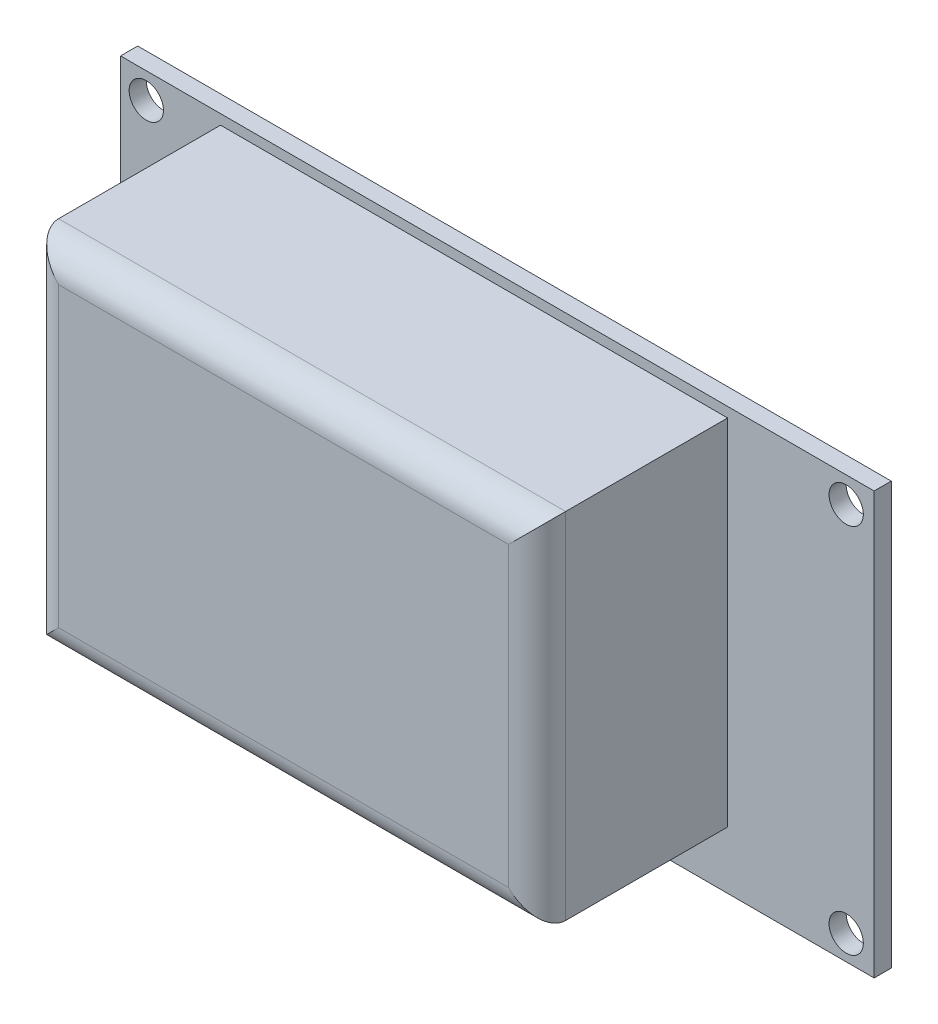
from build123d import *

# Parameters (mm, degrees)
SKETCH1_W           = 67
SKETCH1_H           = 37.49999993
BOSS_EXTRUDE1_DEPTH = 1.524
SKETCH2_R           = 1.524
CUT_EXTRUDE1_DEPTH  = 1.524
SKETCH3_W           = 45.085
SKETCH3_H           = 31.496
BOSS_EXTRUDE2_DEPTH = 16.9418
FILLET1_R           = 2.54


with BuildPart() as part:
    # Sketch1 → Boss-Extrude1 (new body)
    with BuildSketch(Plane.XY):
        Rectangle(SKETCH1_W, SKETCH1_H)
    extrude(amount=BOSS_EXTRUDE1_DEPTH)

    # Sketch2 → Cut-Extrude1 (cut)
    with BuildSketch(Plane.XY.offset(1.524)):
        with Locations((-31.214, 16.463999965)):
            Circle(SKETCH2_R)
        with Locations((31.016, 16.463999965)):
            Circle(SKETCH2_R)
        with Locations((-31.214, -16.556000035)):
            Circle(SKETCH2_R)
        with Locations((31.016, -16.556000035)):
            Circle(SKETCH2_R)
    extrude(amount=-CUT_EXTRUDE1_DEPTH, mode=Mode.SUBTRACT)

    # Sketch3 → Boss-Extrude2 (add)
    with BuildSketch(Plane.XY.offset(1.524)):
        with Locations((-2.0675, 2.112999965)):
            Rectangle(SKETCH3_W, SKETCH3_H)
    extrude(amount=BOSS_EXTRUDE2_DEPTH)

    # Fillet1
    fillet1_edges = [part.edges().sort_by_distance(p)[0] for p in [
        (-24.61, 2.112999965, 18.4658),
        (-2.0675, -13.635000035, 18.4658),
        (20.475, 2.112999965, 18.4658),
        (-2.0675, 17.860999965, 18.4658),
    ]]
    fillet(fillet1_edges, radius=FILLET1_R)


solid = part.part
